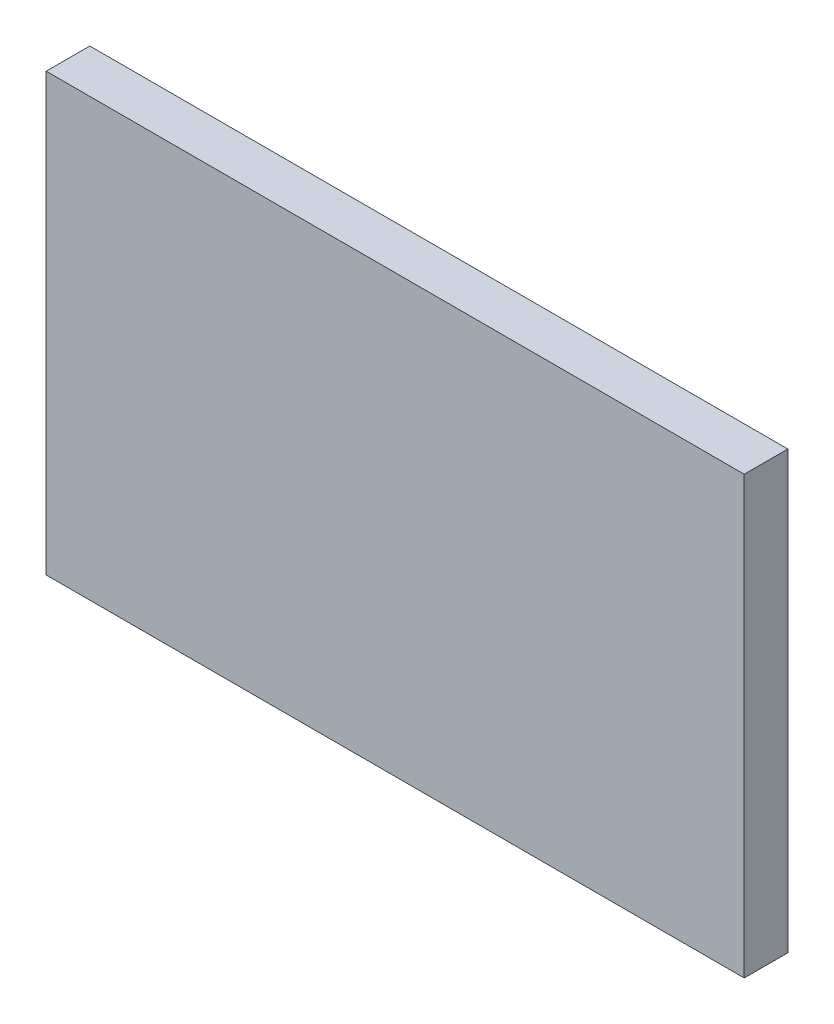
from build123d import *

# Parameters (mm, degrees)
SKETCH1_W           = 101.6
SKETCH1_H           = 63.5
BOSS_EXTRUDE1_DEPTH = 6.35


with BuildPart() as part:
    # Sketch1 → Boss-Extrude1 (new body)
    with BuildSketch(Plane.XY):
        with Locations((50.8, 31.75)):
            Rectangle(SKETCH1_W, SKETCH1_H)
    extrude(amount=BOSS_EXTRUDE1_DEPTH)


solid = part.part
